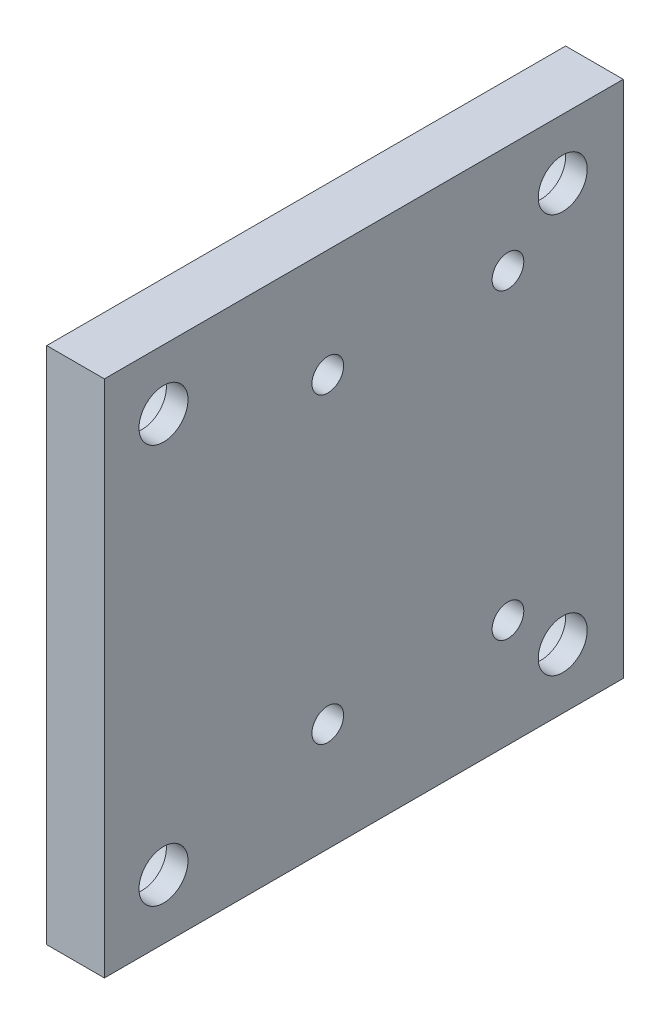
from build123d import *

# Parameters (mm, degrees)
CROQUIS1_W              = 36
CROQUIS1_H              = 36
SALIENTE_EXTRUIR1_DEPTH = 4
CROQUIS2_R              = 1.7
CORTAR_EXTRUIR1_DEPTH   = 6
CROQUIS3_R              = 3.1
CORTAR_EXTRUIR2_DEPTH   = 3.5
CROQUIS4_R              = 1.1
CORTAR_EXTRUIR3_DEPTH   = 6


with BuildPart() as part:
    # Croquis1 → Saliente-Extruir1 (new body)
    with BuildSketch(Plane(origin=(-12.9, 0, 0), x_dir=(0, 0, -1), z_dir=(1, 0, 0))):
        with Locations((-94.5, 0)):
            Rectangle(CROQUIS1_W, CROQUIS1_H)
    extrude(amount=SALIENTE_EXTRUIR1_DEPTH)

    # Croquis2 → Cortar-Extruir1 (cut)
    with BuildSketch(Plane(origin=(-13.9, 0, 0), x_dir=(0, 0, -1), z_dir=(1, 0, 0))):
        with Locations((-80.7, -13.85)):
            Circle(CROQUIS2_R)
        with Locations((-108.4, -13.85)):
            Circle(CROQUIS2_R)
        with Locations((-80.7, 13.85)):
            Circle(CROQUIS2_R)
        with Locations((-108.4, 13.85)):
            Circle(CROQUIS2_R)
    extrude(amount=CORTAR_EXTRUIR1_DEPTH, mode=Mode.SUBTRACT)

    # Croquis3 → Cortar-Extruir2 (cut)
    with BuildSketch(Plane(origin=(-13.9, 0, 0), x_dir=(0, 0, -1), z_dir=(1, 0, 0))):
        with Locations((-80.7, -13.85)):
            Circle(CROQUIS3_R)
        with Locations((-108.4, -13.85)):
            Circle(CROQUIS3_R)
        with Locations((-80.7, 13.85)):
            Circle(CROQUIS3_R)
        with Locations((-108.4, 13.85)):
            Circle(CROQUIS3_R)
    extrude(amount=CORTAR_EXTRUIR2_DEPTH, mode=Mode.SUBTRACT)

    # Croquis4 → Cortar-Extruir3 (cut)
    with BuildSketch(Plane(origin=(-13.9, 0, 0), x_dir=(0, 0, -1), z_dir=(1, 0, 0))):
        with Locations((-97, -10.5)):
            Circle(CROQUIS4_R)
        with Locations((-84.5, -10.5)):
            Circle(CROQUIS4_R)
        with Locations((-97, 10.5)):
            Circle(CROQUIS4_R)
        with Locations((-84.5, 10.5)):
            Circle(CROQUIS4_R)
    extrude(amount=CORTAR_EXTRUIR3_DEPTH, mode=Mode.SUBTRACT)


solid = part.part
